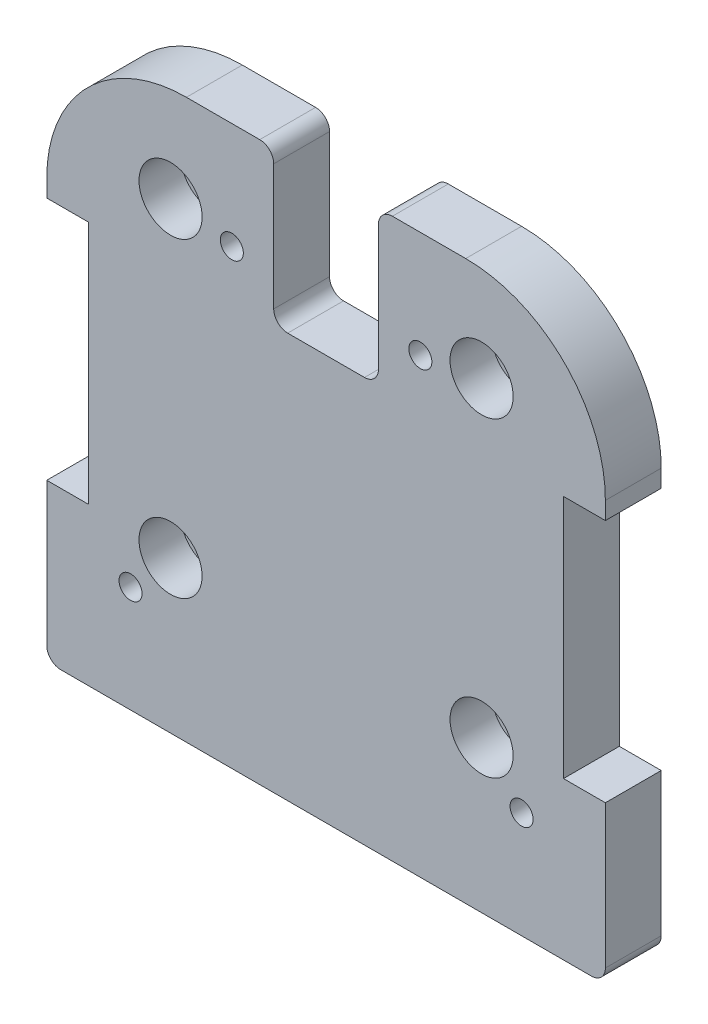
from build123d import *

# Parameters (mm, degrees)
SKETCH_1_W                   = 80
SKETCH_1_H                   = 80
EXTRUDE_1_DEPTH              = 8
SKETCH_7_W                   = 15
SKETCH_7_H                   = 22
CUT_EXTRUDE_1_DEPTH          = 10
HOLE_WIZARD_M4_1_D           = 3.3
HOLE_WIZARD_M4_1_CSINK_D     = 4.05
HOLE_WIZARD_M4_1_CSINK_ANGLE = 90
FILLET_1_R                   = 20
FILLET_2_R                   = 2
SKETCH_9_W                   = 6
SKETCH_9_H                   = 35
CUT_EXTRUDE_2_DEPTH          = 11
SKETCH_11_R                  = 3
CUT_EXTRUDE_4_DEPTH          = 15
CUT_EXTRUDE_5_DEPTH          = 3.6
SKETCH_13_R                  = 4.52
CUT_EXTRUDE_6_DEPTH          = 6


with BuildPart() as part:
    # 草图1 → 凸台-拉伸1 (new body)
    with BuildSketch(Plane.XY):
        Rectangle(SKETCH_1_W, SKETCH_1_H)
    extrude(amount=EXTRUDE_1_DEPTH)

    # 草图7 → 切除-拉伸1 (cut)
    with BuildSketch(Plane.XY.offset(8)):
        with Locations((0, 29)):
            Rectangle(SKETCH_7_W, SKETCH_7_H)
    extrude(amount=-CUT_EXTRUDE_1_DEPTH, mode=Mode.SUBTRACT)

    # M4 螺纹孔1 (through all)
    with Locations(Plane(origin=(13.5, 24.75, 0), x_dir=(-1, 0, 0), z_dir=(0, 0, -1))):
        with Locations((0, 0), (27, 0), (41.5, -49.5), (-14.5, -49.5)):
            CounterSinkHole(HOLE_WIZARD_M4_1_D / 2, HOLE_WIZARD_M4_1_CSINK_D / 2, counter_sink_angle=HOLE_WIZARD_M4_1_CSINK_ANGLE)

    # 圆角1
    fillet_1_edges = [part.edges().sort_by_distance(p)[0] for p in [
        (-40, 40, 4),
        (40, 40, 4),
    ]]
    fillet(fillet_1_edges, radius=FILLET_1_R)

    # 圆角2
    fillet_2_edges = [part.edges().sort_by_distance(p)[0] for p in [
        (-7.5, 18, 4),
        (-7.5, 40, 4),
        (7.5, 40, 4),
        (7.5, 18, 4),
        (40, -40, 4),
        (-40, -40, 4),
    ]]
    fillet(fillet_2_edges, radius=FILLET_2_R)

    # 草图9 → 切除-拉伸2 (cut)
    with BuildSketch(Plane.XY):
        with Locations((37, 0)):
            Rectangle(SKETCH_9_W, SKETCH_9_H)
        with Locations((-37, 0)):
            Rectangle(SKETCH_9_W, SKETCH_9_H)
    extrude(amount=CUT_EXTRUDE_2_DEPTH, mode=Mode.SUBTRACT)

    # 草图11 → 切除-拉伸4 (cut)
    with BuildSketch(Plane.XY):
        with Locations((-22.273863607, 26.273863607)):
            Circle(SKETCH_11_R)
        with Locations((22.273863607, 26.273863607)):
            Circle(SKETCH_11_R)
        with Locations((22.273863607, -18.273863607)):
            Circle(SKETCH_11_R)
        with Locations((-22.273863607, -18.273863607)):
            Circle(SKETCH_11_R)
    extrude(amount=CUT_EXTRUDE_4_DEPTH, mode=Mode.SUBTRACT)

    # 草图12 → 切除-拉伸5 (cut)
    with BuildSketch(Plane.XY):
        Polygon((11.531235582, 21.34), (15.468764418, 21.34), (17.437528836, 24.75), (15.468764418, 28.16), (11.531235582, 28.16), (9.562471164, 24.75), align=None)
        Polygon((26.031235582, -28.16), (29.968764418, -28.16), (31.937528836, -24.75), (29.968764418, -21.34), (26.031235582, -21.34), (24.062471164, -24.75), align=None)
        Polygon((-24.062471164, -24.75), (-26.031235582, -28.16), (-29.968764418, -28.16), (-31.937528836, -24.75), (-29.968764418, -21.34), (-26.031235582, -21.34), align=None)
        Polygon((-9.562471164, 24.75), (-11.531235582, 21.34), (-15.468764418, 21.34), (-17.437528836, 24.75), (-15.468764418, 28.16), (-11.531235582, 28.16), align=None)
    extrude(amount=CUT_EXTRUDE_5_DEPTH, mode=Mode.SUBTRACT)

    # 草图13 → 切除-拉伸6 (cut)
    with BuildSketch(Plane.XY.offset(8)):
        with Locations((-22.273863607, 26.273863607)):
            Circle(SKETCH_13_R)
        with Locations((-22.273863607, -18.273863607)):
            Circle(SKETCH_13_R)
        with Locations(Location((22.273863607, -18.273863607, 0), (0, 0, 180))):
            Circle(SKETCH_13_R)
        with Locations(Location((22.273863607, 26.273863607, 0), (0, 0, 180))):
            Circle(SKETCH_13_R)
    extrude(amount=-CUT_EXTRUDE_6_DEPTH, mode=Mode.SUBTRACT)


solid = part.part
